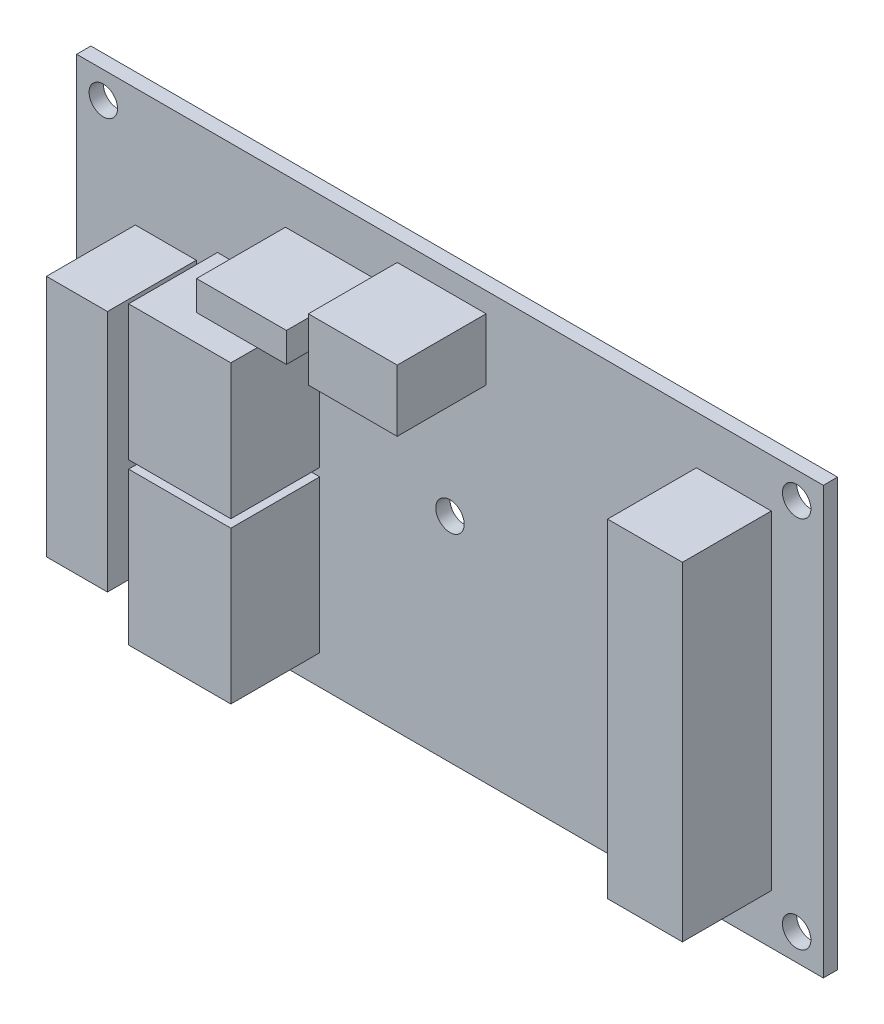
from build123d import *

# Parameters (mm, degrees)
SKETCH1_W           = 84
SKETCH1_H           = 48
BOSS_EXTRUDE1_DEPTH = 0.8
SKETCH2_R           = 1.6
CUT_EXTRUDE1_DEPTH  = 49.4
SKETCH3_W           = 6.862119169
SKETCH3_H           = 27.332124702
SKETCH3_W_2         = 10.110629261
SKETCH3_H_2         = 3.312844108
SKETCH3_W_3         = 9.995650326
SKETCH3_H_3         = 6.943369618
SKETCH3_W_4         = 11.50293093
SKETCH3_H_4         = 17.135400557
SKETCH3_H_5         = 15.193388494
SKETCH3_W_5         = 8.420598576
SKETCH3_H_6         = 36.987675992
BOSS_EXTRUDE2_DEPTH = 10


with BuildPart() as part:
    # Sketch1 → Boss-Extrude1 (new, symmetric)
    with BuildSketch(Plane.XY):
        Rectangle(SKETCH1_W, SKETCH1_H)
    extrude(amount=BOSS_EXTRUDE1_DEPTH, both=True)

    # Sketch2 → Cut-Extrude1 (cut, through all)
    with BuildSketch(Plane.XY.offset(0.8)):
        with Locations((-39, -21)):
            Circle(SKETCH2_R)
        with Locations((-39, 21)):
            Circle(SKETCH2_R)
        Circle(SKETCH2_R)
        with Locations((39, -21)):
            Circle(SKETCH2_R)
        with Locations((39, 21)):
            Circle(SKETCH2_R)
    extrude(amount=-CUT_EXTRUDE1_DEPTH, mode=Mode.SUBTRACT)

    # Sketch3 → Boss-Extrude2 (add)
    with BuildSketch(Plane.XY.offset(0.8)):
        with Locations((-31.966191102, -3.002126176)):
            Rectangle(SKETCH3_W, SKETCH3_H)
        with Locations((-13.456350493, 17.232506389)):
            Rectangle(SKETCH3_W_2, SKETCH3_H_2)
        with Locations((-0.93444373, 18.273143727)):
            Rectangle(SKETCH3_W_3, SKETCH3_H_3)
        with Locations((-20.403749308, -12.069028564)):
            Rectangle(SKETCH3_W_4, SKETCH3_H_4)
        with Locations((-20.403749308, 5.009253991)):
            Rectangle(SKETCH3_W_4, SKETCH3_H_5)
        with Locations((31.938626633, 0.080507911)):
            Rectangle(SKETCH3_W_5, SKETCH3_H_6)
    extrude(amount=BOSS_EXTRUDE2_DEPTH)


solid = part.part
